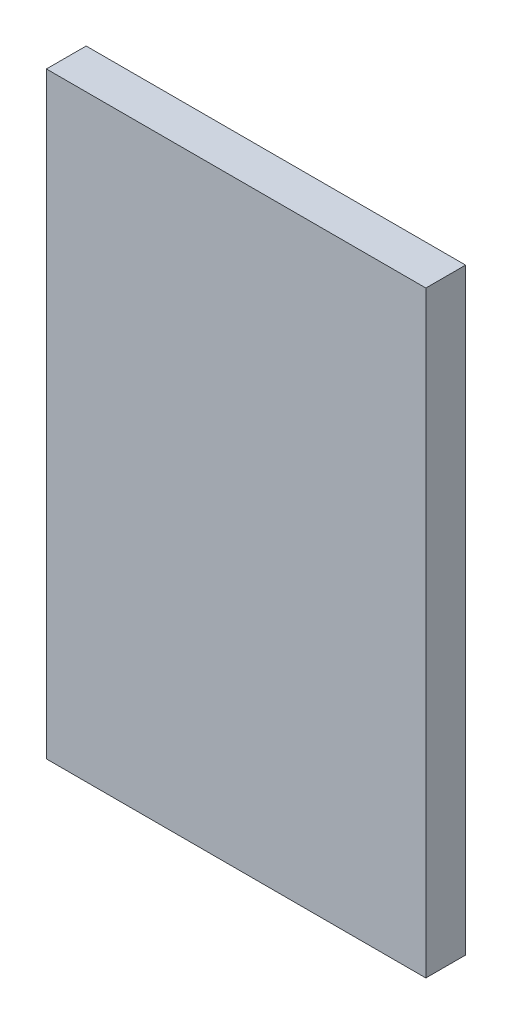
from build123d import *

# Parameters (mm, degrees)
SKETCH1_W           = 25.4
SKETCH1_H           = 40
BOSS_EXTRUDE1_DEPTH = 2.66


with BuildPart() as part:
    # Sketch1 → Boss-Extrude1 (new body)
    with BuildSketch(Plane.XY):
        with Locations((12.7, 20)):
            Rectangle(SKETCH1_W, SKETCH1_H)
    extrude(amount=BOSS_EXTRUDE1_DEPTH)


solid = part.part
